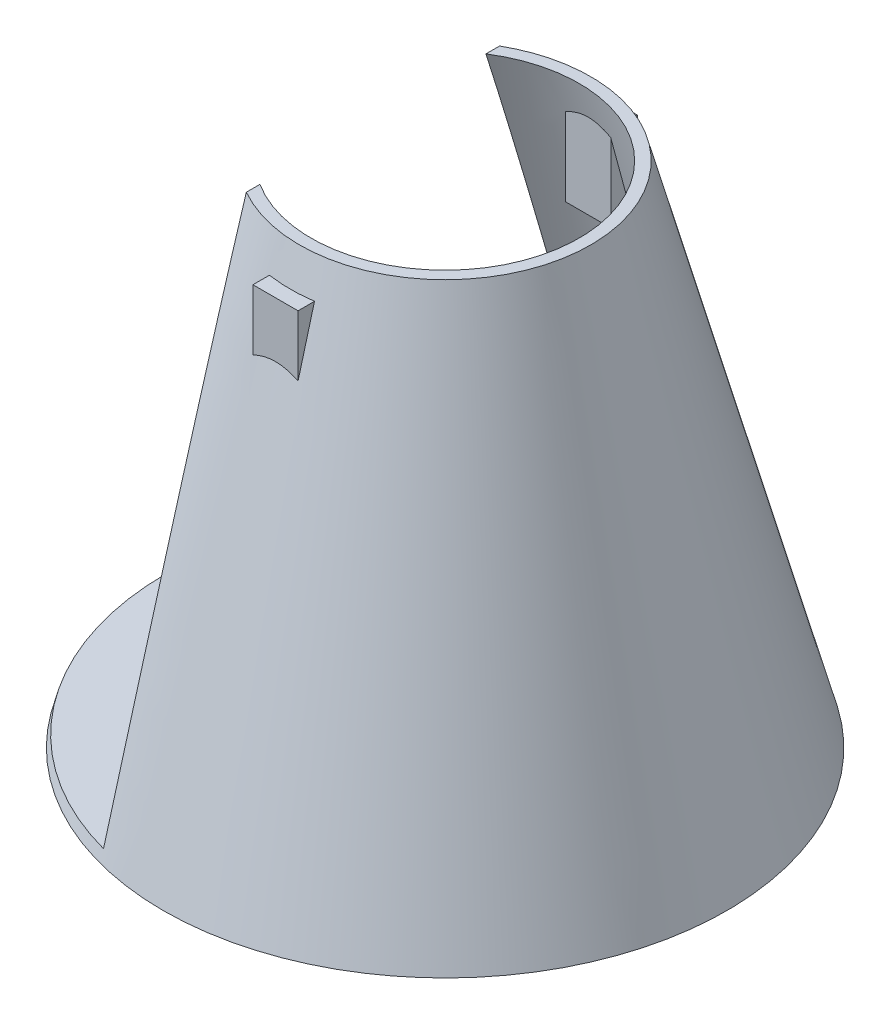
from build123d import *

# Parameters (mm, degrees)
SCHNITT_LINEAR_AUSTRAGEN1_DEPTH      = 172.863460215
SCHNITT_LINEAR_AUSTRAGEN1_DEPTH_BACK = 172.863460215
AUFSATZ_LINEAR_AUSTRAGEN1_DEPTH      = 29
SCHNITT_LINEAR_AUSTRAGEN3_DEPTH      = 39
SCHNITT_LINEAR_AUSTRAGEN4_DEPTH      = 172.863460215
SCHNITT_LINEAR_AUSTRAGEN4_DEPTH_BACK = 172.863460215
SKIZZE8_W                            = 12
SKIZZE8_H                            = 22.5
AUFSATZ_LINEAR_AUSTRAGEN2_DEPTH      = 7.05
SKIZZE9_W                            = 12
SKIZZE9_H                            = 22.5
AUFSATZ_LINEAR_AUSTRAGEN3_DEPTH      = 7.05


with BuildPart() as part:
    # Skizze2 → Rotation1 (revolve)
    with BuildSketch(Plane.XY, mode=Mode.PRIVATE) as rotation1_sk:
        Polygon((0, 0), (75, 0), (38.765333686, 135.22961568), (35.659505144, 135.22961568), (71.090323881, 3), (0, 3), align=None)
    revolve(rotation1_sk.sketch.rotate(Axis((0, 3, 0), (0, -1, 0)), 90), axis=Axis((0, 3, 0), (0, -1, 0)))

    # Skizze3 → Schnitt-Linear austragen1 (cut, two sides: drawn at the far end of the back side and taken through both)
    with BuildSketch(Plane.XY.offset(-SCHNITT_LINEAR_AUSTRAGEN1_DEPTH_BACK)):
        Polygon((-38.765333686, 135.22961568), (-74.196152423, 3), (-19.196152423, 3), (-19.196152423, 135.22961568), align=None)
    extrude(amount=SCHNITT_LINEAR_AUSTRAGEN1_DEPTH + SCHNITT_LINEAR_AUSTRAGEN1_DEPTH_BACK, mode=Mode.SUBTRACT)

    # Skizze4 → Aufsatz-Linear austragen1 (add)
    with BuildSketch(Plane(origin=(0, 3, 0), x_dir=(1, 0, 0), z_dir=(0, 1, 0))):
        Polygon((3.5, -17), (3.5, -9), (10.5, -9), (10.5, 32), (-10.5, 32), (-10.5, -9), (-3.5, -9), (-3.5, -17), (-13.5, -17), (-13.5, 40), (13.5, 40), (13.5, -17), align=None)
    extrude(amount=AUFSATZ_LINEAR_AUSTRAGEN1_DEPTH)

    # Skizze6 → Schnitt-Linear austragen3 (cut)
    with BuildSketch(Plane.ZY.offset(13.5)):
        Polygon((-11.5, 19.456510087), (-30, 32), (7, 32), align=None)
    extrude(amount=-SCHNITT_LINEAR_AUSTRAGEN3_DEPTH, mode=Mode.SUBTRACT)

    # Skizze7 → Schnitt-Linear austragen4 (cut, two sides: drawn at the far end of the back side and taken through both)
    with BuildSketch(Plane.XY.offset(-SCHNITT_LINEAR_AUSTRAGEN4_DEPTH_BACK)):
        with BuildLine():
            ThreePointArc((2.852715163, 114.951167405), (0, 126.22961568), (-2.852715163, 114.951167405))
            ThreePointArc((-2.852715163, 114.951167405), (0, 111.52961568), (2.852715163, 114.951167405))
        make_face()
    extrude(amount=SCHNITT_LINEAR_AUSTRAGEN4_DEPTH + SCHNITT_LINEAR_AUSTRAGEN4_DEPTH_BACK, mode=Mode.SUBTRACT)

    # Skizze8 → Aufsatz-Linear austragen2 (add)
    with BuildSketch(Plane.XY.offset(-45.115728763)):
        with Locations((0, 114.97961568)):
            Rectangle(SKIZZE8_W, SKIZZE8_H)
    extrude(amount=AUFSATZ_LINEAR_AUSTRAGEN2_DEPTH)

    # Skizze9 → Aufsatz-Linear austragen3 (add)
    with BuildSketch(Plane.XY.offset(45.115728763)):
        with Locations((0, 114.97961568)):
            Rectangle(SKIZZE9_W, SKIZZE9_H)
    extrude(amount=-AUFSATZ_LINEAR_AUSTRAGEN3_DEPTH)


solid = part.part
